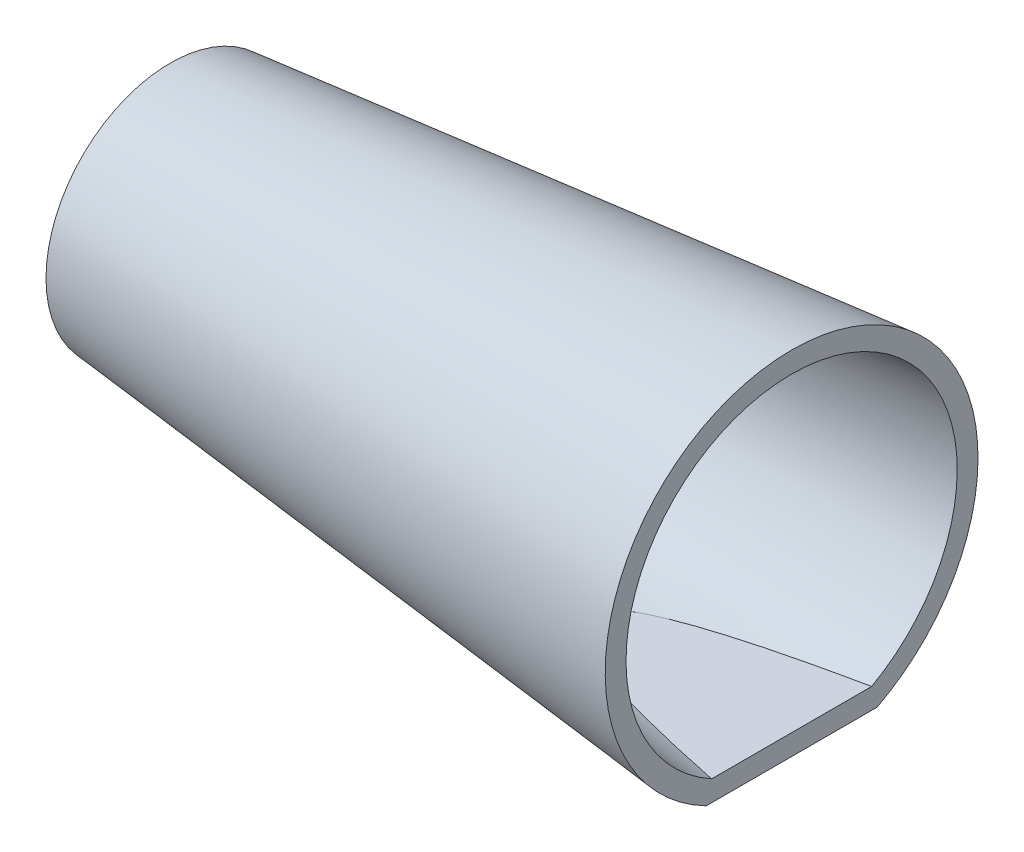
from build123d import *

# Parameters (mm, degrees)
BOSS_EXTRUDE1_REACH = 164.942
CUT_EXTRUDE1_DEPTH  = 163.941707368


with BuildPart() as part:
    # Sketch1 → Revolve1 (revolve)
    with BuildSketch(Plane.XY, mode=Mode.PRIVATE) as revolve1_sk:
        Polygon((-78.541169384, 30), (71.458830616, 45), (71.458830616, 39.975062189), (-78.541169384, 24.975062189), align=None)
    revolve(revolve1_sk.sketch.rotate(Axis((-78.541169384, 0, 0), (1, 0, 0)), 90), axis=Axis((-78.541169384, 0, 0), (1, 0, 0)))

    # Sketch3 → Boss-Extrude1 (add, up to next)
    with BuildSketch(Plane(origin=(71.458830616, 0, 0), x_dir=(0, 0, -1), z_dir=(1, 0, 0)), mode=Mode.PRIVATE) as boss_extrude1_sk1:
        with BuildLine():
            Line((-20.615528128, -40), (20.615528128, -40))
            ThreePointArc((20.615528128, -40), (24.577379737, -37.69552235), (28.284271247, -35))
            Line((28.284271247, -35), (-28.284271247, -35))
            ThreePointArc((-28.284271247, -35), (-24.577379737, -37.69552235), (-20.615528128, -40))
        make_face()
    boss_extrude1_tool1 = extrude(boss_extrude1_sk1.sketch, amount=-BOSS_EXTRUDE1_REACH, mode=Mode.PRIVATE) - part.part
    add(boss_extrude1_tool1.solids().sort_by_distance((71.458831, -37.37172, 0))[0])

    # Sketch4 → Cut-Extrude1 (cut, through all)
    with BuildSketch(Plane(origin=(71.458830616, 0, 0), x_dir=(0, 0, -1), z_dir=(1, 0, 0))):
        with BuildLine():
            Line((-20.615528128, -40), (20.615528128, -40))
            ThreePointArc((20.615528128, -40), (0, -45), (-20.615528128, -40))
        make_face()
    extrude(amount=-CUT_EXTRUDE1_DEPTH, mode=Mode.SUBTRACT)


solid = part.part
